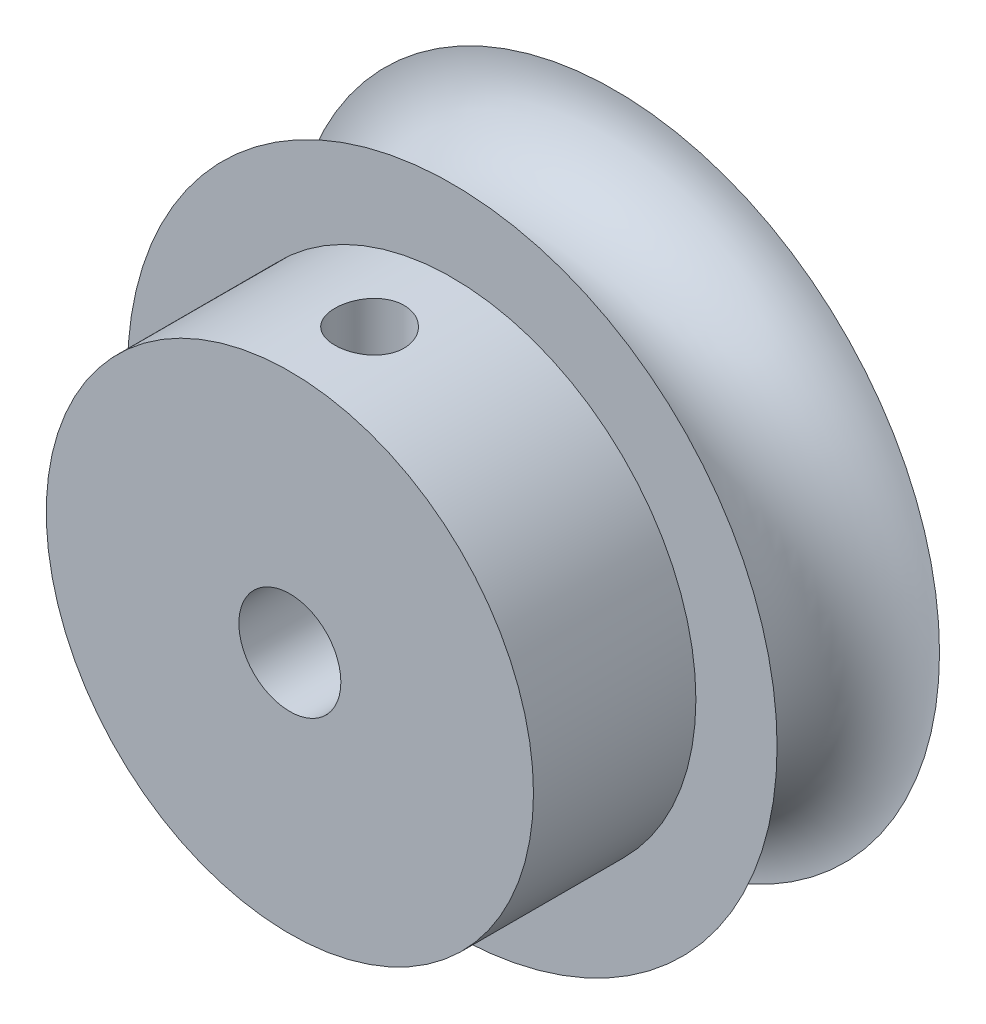
from build123d import *

# Parameters (mm, degrees)
SKETCH1_R                 = 12.7
BOSS_EXTRUDE1_DEPTH       = 6.35
SKETCH2_R                 = 9.525
BOSS_EXTRUDE2_DEPTH       = 6.35
SKETCH3_R                 = 1.9939
CUT_EXTRUDE1_DEPTH        = 12.7
F_6_32_TAPPED_HOLE1_D     = 2.7051
F_6_32_TAPPED_HOLE1_DEPTH = 9.524
F_6_32_TAPPED_HOLE1_TIP   = 0.81269403


with BuildPart() as part:
    # Sketch1 → Boss-Extrude1 (new body)
    with BuildSketch(Plane.XY):
        Circle(SKETCH1_R)
    extrude(amount=BOSS_EXTRUDE1_DEPTH)

    # Sketch2 → Boss-Extrude2 (add)
    with BuildSketch(Plane.XY.offset(6.35)):
        Circle(SKETCH2_R)
    extrude(amount=BOSS_EXTRUDE2_DEPTH)

    # Sketch3 → Cut-Extrude1 (cut)
    with BuildSketch(Plane.XY.offset(12.7)):
        Circle(SKETCH3_R)
    extrude(amount=-CUT_EXTRUDE1_DEPTH, mode=Mode.SUBTRACT)

    # Sketch4 → Cut-Revolve1 (revolve, cut)
    with BuildSketch(Plane(origin=(0, 0, 0), x_dir=(1, 0, 0), z_dir=(0, 1, 0)), mode=Mode.PRIVATE) as cut_revolve1_sk:
        with BuildLine():
            Line((12.7, 0), (12.7, -6.35))
            ThreePointArc((12.7, -6.35), (9.525, -3.175), (12.7, 0))
        make_face()
    revolve(cut_revolve1_sk.sketch.rotate(Axis((0, 0, -3.575887172), (0, 0, 1)), 180), axis=Axis((0, 0, -3.575887172), (0, 0, 1)), mode=Mode.SUBTRACT)

    # #6-32 Tapped Hole1
    with Locations(Plane(origin=(-9.4e-08, 9.525, 9.584004604), x_dir=(1.0, 9.833e-09, 0), z_dir=(-9.833e-09, 1.0, 0))):
        with Locations((0, 0)):
            Hole(F_6_32_TAPPED_HOLE1_D / 2, depth=F_6_32_TAPPED_HOLE1_DEPTH)
            with Locations((0, 0, -(F_6_32_TAPPED_HOLE1_DEPTH + F_6_32_TAPPED_HOLE1_TIP / 2))):  # 118° drill point
                Cone(0, F_6_32_TAPPED_HOLE1_D / 2, F_6_32_TAPPED_HOLE1_TIP, mode=Mode.SUBTRACT)


solid = part.part
